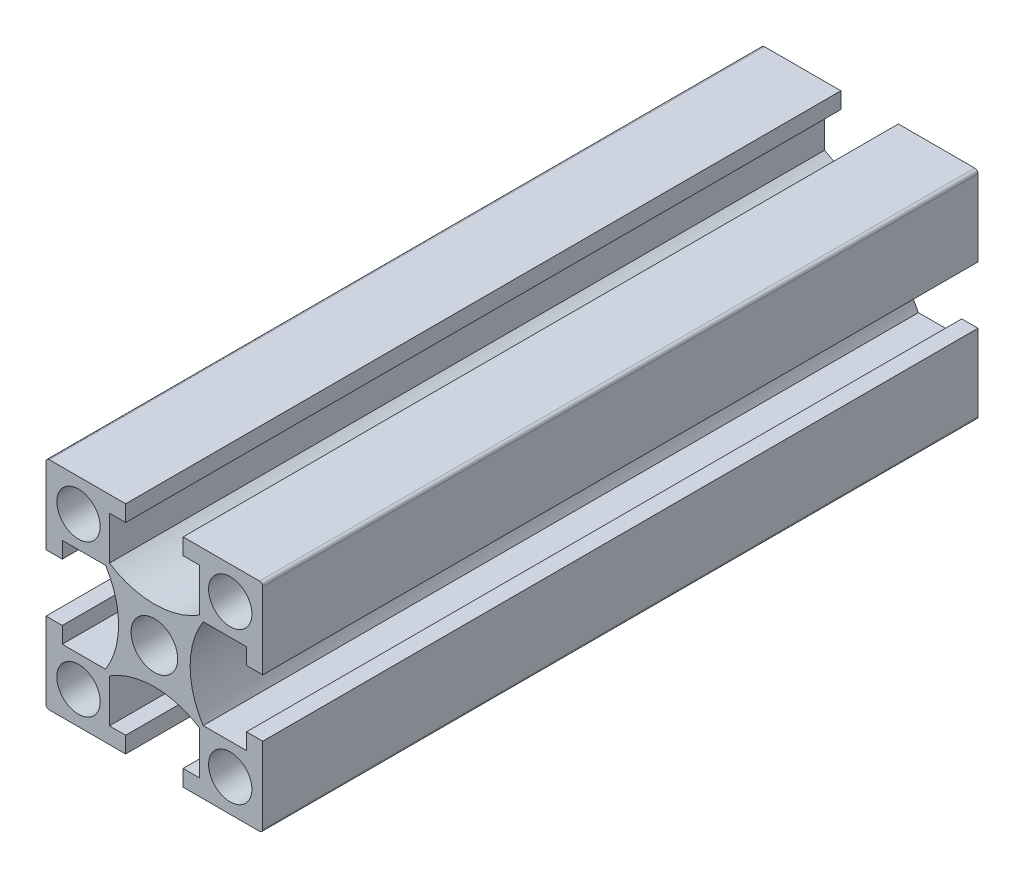
from build123d import *

# Parameters (mm, degrees)
SKETCH_1_W               = 20
SKETCH_1_H               = 20
SKETCH_1_R               = 2
SKETCH_1_R_2             = 2.15
EXTRUDE_1_DEPTH          = 66
CUT_EXTRUDE_1_REACH      = 69.498
PATTERN_CIRCULAR_1_COUNT = 4
FILLET_1_R               = 0.3


with BuildPart() as part:
    # 스케치1 → 보스-돌출1 (new body)
    with BuildSketch(Plane.XY):
        Rectangle(SKETCH_1_W, SKETCH_1_H)
        with Locations((-7, -7)):
            Circle(SKETCH_1_R, mode=Mode.SUBTRACT)
        with Locations((7, -7)):
            Circle(SKETCH_1_R, mode=Mode.SUBTRACT)
        with Locations((-7, 7)):
            Circle(SKETCH_1_R, mode=Mode.SUBTRACT)
        Circle(SKETCH_1_R_2, mode=Mode.SUBTRACT)
        with Locations((7, 7)):
            Circle(SKETCH_1_R, mode=Mode.SUBTRACT)
    extrude(amount=EXTRUDE_1_DEPTH)

    # 스케치1<3> → 컷-돌출1 (cut, up to next)
    with BuildSketch(Plane.XY, mode=Mode.PRIVATE) as cut_extrude_1_sk1:
        with BuildLine():
            Line((-8.5, 2.65), (-10, 2.65))
            Line((-10, 2.65), (-10, -2.65))
            Line((-10, -2.65), (-8.5, -2.65))
            Line((-8.5, -2.65), (-8.5, -4.15))
            Line((-8.5, -4.15), (-4.503166667, -4.15))
            ThreePointArc((-4.503166667, -4.15), (-3.3, 0), (-4.503166667, 4.15))
            Line((-4.503166667, 4.15), (-8.5, 4.15))
            Line((-8.5, 4.15), (-8.5, 2.65))
        make_face()
    cut_extrude_1_tool1 = extrude(cut_extrude_1_sk1.sketch, amount=CUT_EXTRUDE_1_REACH, mode=Mode.PRIVATE) & part.part
    cut_extrude_1 = cut_extrude_1_tool1.solids().sort_by_distance((-6.606913, 0, 0))[0]
    add(cut_extrude_1, mode=Mode.SUBTRACT)

    # 원형 패턴1: 컷-돌출1 ×4 about axis
    pattern_circular_1_axis = Axis((0, 0, 66), (0, 0, -1))
    for i in range(1, PATTERN_CIRCULAR_1_COUNT):
        add(cut_extrude_1.rotate(pattern_circular_1_axis, i * 360 / PATTERN_CIRCULAR_1_COUNT), mode=Mode.SUBTRACT)

    # 필렛1
    fillet_1_edges = [part.edges().sort_by_distance(p)[0] for p in [
        (10, -10, 33),
        (-10, -10, 33),
        (-10, 10, 33),
        (10, 10, 33),
    ]]
    fillet(fillet_1_edges, radius=FILLET_1_R)


solid = part.part
